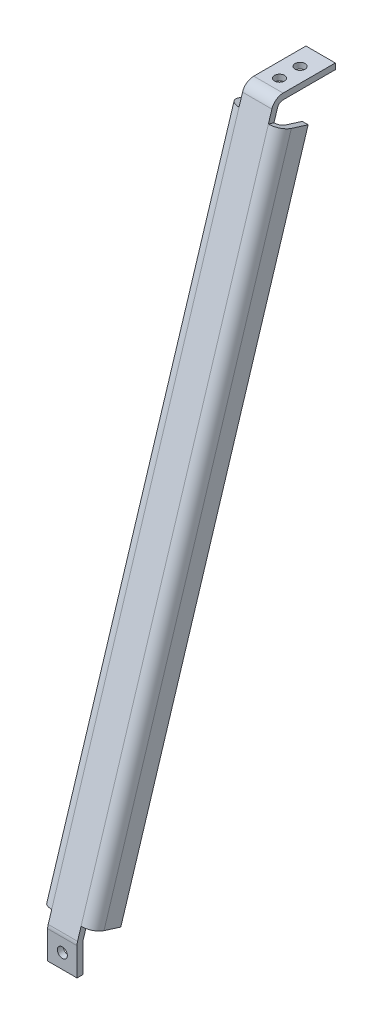
from build123d import *

# Parameters (mm, degrees)
FORMED_WEB_DEPTH           = 10
EDGE_STIFFENING_LIPS_DEPTH = 214.533668262
WALL_MOUNT_HOLE_SKETCH_R   = 1.7
WALL_MOUNT_HOLES_DEPTH     = 2.4
COVER_MOUNT_HOLE_SKETCH_R  = 1.7
COVER_MOUNT_HOLE_DEPTH     = 2.4


with BuildPart() as part:
    # Formed Web Section Sketch → Formed Web (new body)
    with BuildSketch(Plane(origin=(185, 0, 0), x_dir=(0, 0, -1), z_dir=(1, 0, 0))):
        with BuildLine():
            Line((-22, -64), (-39.792590359, -64))
            ThreePointArc((-39.792590359, -64), (-42.163216653, -64.778178935), (-43.611457224, -66.809934512))
            Line((-43.611457224, -66.809934512), (-109.818866865, -279.266547538))
            ThreePointArc((-109.818866865, -279.266547538), (-109.954457451, -279.854727432), (-110, -280.456613027))
            Line((-110, -280.456613027), (-110, -290))
            Line((-110, -290), (-108, -290))
            Line((-108, -290), (-108, -280.456613027))
            ThreePointArc((-108, -280.456613027), (-107.977228725, -280.155670229), (-107.909433433, -279.861580283))
            Line((-107.909433433, -279.861580283), (-41.702023792, -67.404967256))
            ThreePointArc((-41.702023792, -67.404967256), (-40.977903506, -66.389089467), (-39.792590359, -66))
            Line((-39.792590359, -66), (-22, -66))
            Line((-22, -66), (-22, -64))
        make_face()
    extrude(amount=FORMED_WEB_DEPTH)

    # Edge Lip Sketch → Edge Stiffening Lips (add)
    with BuildSketch(Plane(origin=(0, -77.102620151, 24.02732814), x_dir=(-1, 0, 0), z_dir=(0, -0.9547167162884552, 0.297516372052681))):
        with BuildLine():
            Line((-181, -17.759537901), (-181, -11.759537901))
            Line((-181, -11.759537901), (-183, -11.759537901))
            Line((-183, -11.759537901), (-183, -17.759537901))
            ThreePointArc((-183, -17.759537901), (-183.585786438, -19.173751463), (-185, -19.759537901))
            Line((-185, -19.759537901), (-185.1, -19.759537901))
            Line((-185.1, -19.759537901), (-185.1, -21.759537901))
            Line((-185.1, -21.759537901), (-185, -21.759537901))
            ThreePointArc((-185, -21.759537901), (-182.171572875, -20.587965025), (-181, -17.759537901))
        make_face()
        with BuildLine():
            Line((-199, -17.759537901), (-199, -11.759537901))
            Line((-199, -11.759537901), (-197, -11.759537901))
            Line((-197, -11.759537901), (-197, -17.759537901))
            ThreePointArc((-197, -17.759537901), (-196.414213562, -19.173751463), (-195, -19.759537901))
            Line((-195, -19.759537901), (-194.9, -19.759537901))
            Line((-194.9, -19.759537901), (-194.9, -21.759537901))
            Line((-194.9, -21.759537901), (-195, -21.759537901))
            ThreePointArc((-195, -21.759537901), (-197.828427125, -20.587965025), (-199, -17.759537901))
        make_face()
    extrude(amount=EDGE_STIFFENING_LIPS_DEPTH)

    # Wall Mount Hole Sketch → Wall Mount Holes (cut)
    with BuildSketch(Plane(origin=(0, -63.8, 0), x_dir=(-1, 0, 0), z_dir=(0, -1, 0))):
        with Locations(Location((-190, -29, 0), (0, 0, 270))):
            Circle(WALL_MOUNT_HOLE_SKETCH_R)
        with Locations(Location((-190, -36, 0), (0, 0, 270))):
            Circle(WALL_MOUNT_HOLE_SKETCH_R)
    extrude(amount=WALL_MOUNT_HOLES_DEPTH, mode=Mode.SUBTRACT)

    # Cover Mount Hole Sketch → Cover Mount Hole (cut)
    with BuildSketch(Plane.XY.offset(107.8)):
        with Locations(Location((190, -285, 0), (0, 0, 180))):
            Circle(COVER_MOUNT_HOLE_SKETCH_R)
    extrude(amount=COVER_MOUNT_HOLE_DEPTH, mode=Mode.SUBTRACT)


solid = part.part
